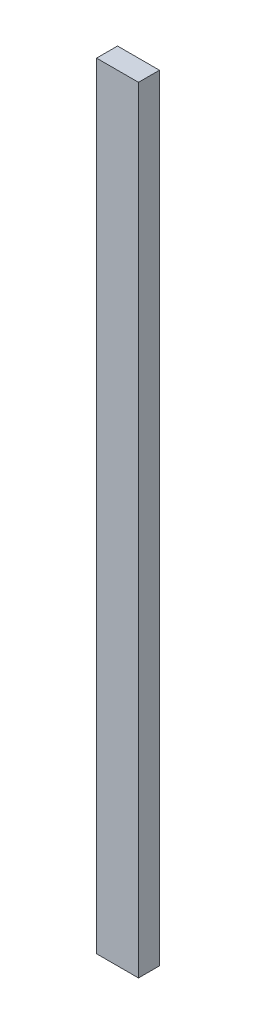
from build123d import *

# Parameters (mm, degrees)
SKETCH1_W           = 20
SKETCH1_H           = 370
BOSS_EXTRUDE1_DEPTH = 10


with BuildPart() as part:
    # Sketch1 → Boss-Extrude1 (new body)
    with BuildSketch(Plane.XY):
        with Locations((10, -185)):
            Rectangle(SKETCH1_W, SKETCH1_H)
    extrude(amount=BOSS_EXTRUDE1_DEPTH)


solid = part.part
